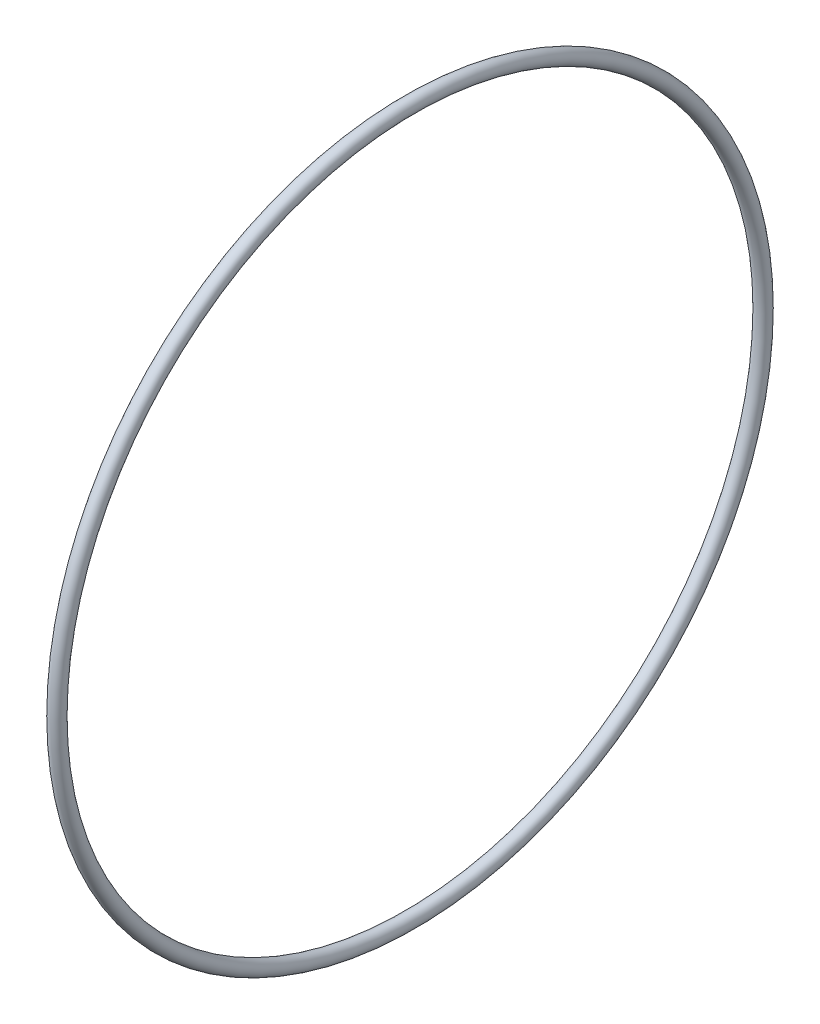
from build123d import *

# Parameters (mm, degrees)
SKETCH1_R = 1.27


with BuildPart() as part:
    # Sketch1 → Revolve2 (revolve)
    with BuildSketch(Plane.XY, mode=Mode.PRIVATE) as revolve2_sk:
        with Locations((0, 62.23)):
            Circle(SKETCH1_R)
    revolve(revolve2_sk.sketch.rotate(Axis((-22.180929287, 0, 0), (1, 0, 0)), 90), axis=Axis((-22.180929287, 0, 0), (1, 0, 0)))


solid = part.part
